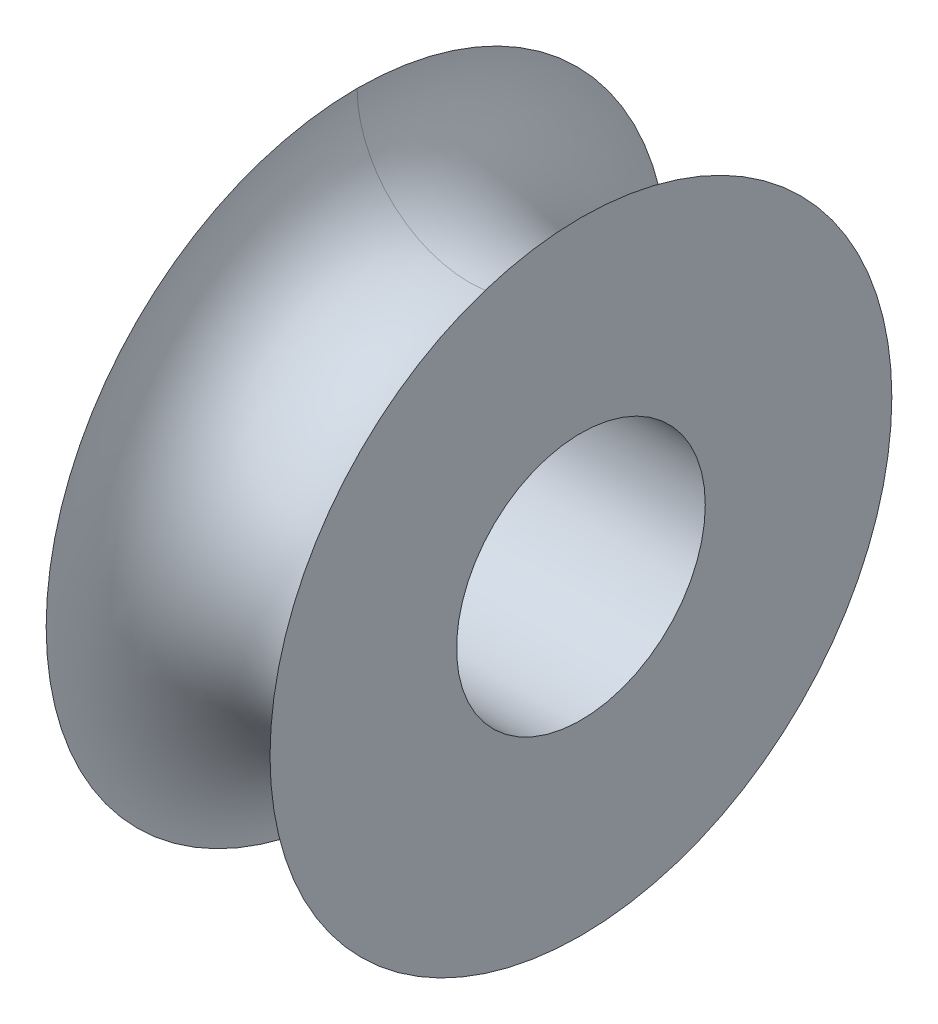
from build123d import *

# Parameters (mm, degrees)
SKETCH1_R           = 2.5
SKETCH1_R_2         = 1
BOSS_EXTRUDE1_DEPTH = 1.8


with BuildPart() as part:
    # Sketch1 → Boss-Extrude1 (new body)
    with BuildSketch(Plane(origin=(0, 0, 0), x_dir=(0, 0, -1), z_dir=(1, 0, 0))):
        Circle(SKETCH1_R)
        Circle(SKETCH1_R_2, mode=Mode.SUBTRACT)
    extrude(amount=BOSS_EXTRUDE1_DEPTH)

    # Cut-Sweep5: sweep along a curve in space
    with BuildLine() as cut_sweep5_path:
        ThreePointArc((0, 0, -2.5), (0, 1.767766953, -1.767766953), (0, 2.5, 0))
        ThreePointArc((0, 2.5, 0), (0, 1.767766953, 1.767766953), (0, 0, 2.5))
        ThreePointArc((0, 0, 2.5), (0, -1.767766953, 1.767766953), (0, -2.5, 0))
        ThreePointArc((0, -2.5, 0), (0, -1.767766953, -1.767766953), (0, 0, -2.5))
    # Sketch21 → Cut-Sweep5 (sweep, cut)
    with BuildSketch(Plane.XY):
        with BuildLine():
            Line((0, 2.5), (1.8, 2.5))
            ThreePointArc((1.8, 2.5), (0.9, 1.6), (0, 2.5))
        make_face()
    sweep(path=cut_sweep5_path.line, mode=Mode.SUBTRACT)


solid = part.part
